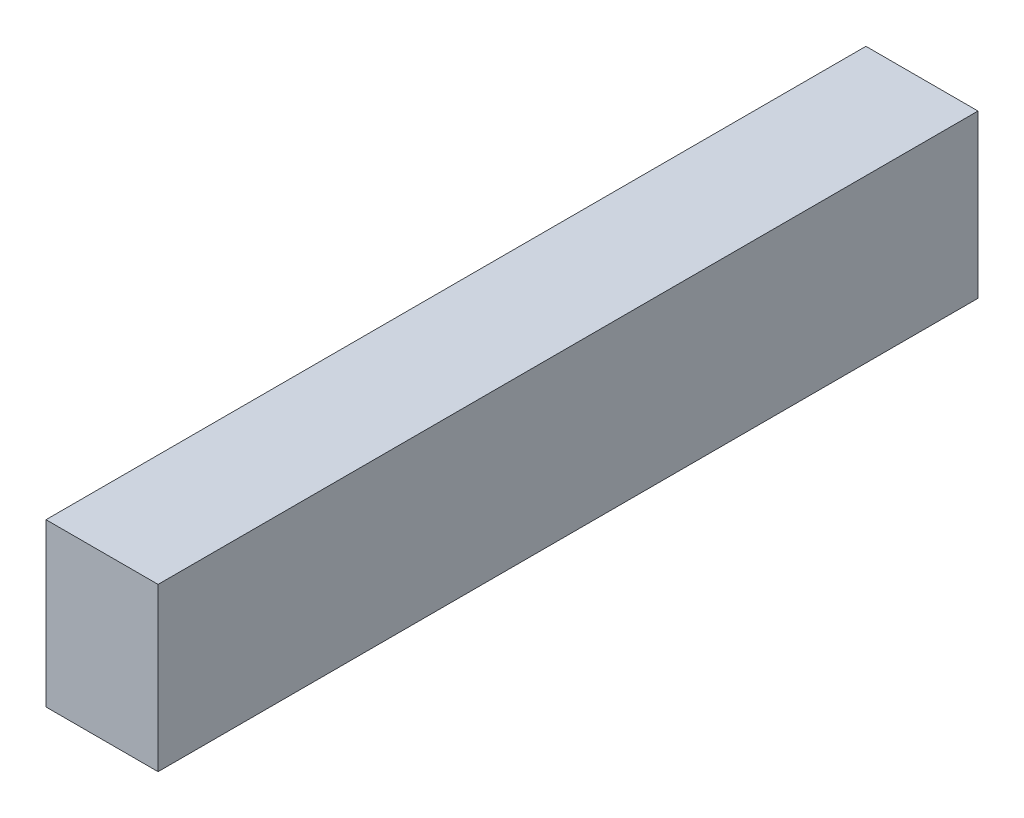
from build123d import *

# Parameters (mm, degrees)
SKETCH1_W           = 3.8
SKETCH1_H           = 27.8
BOSS_EXTRUDE1_DEPTH = 5.5


with BuildPart() as part:
    # Sketch1 → Boss-Extrude1 (new body)
    with BuildSketch(Plane(origin=(0, 0, 0), x_dir=(1, 0, 0), z_dir=(0, 1, 0))):
        with Locations((1.9, 13.9)):
            Rectangle(SKETCH1_W, SKETCH1_H)
    extrude(amount=BOSS_EXTRUDE1_DEPTH)


solid = part.part
